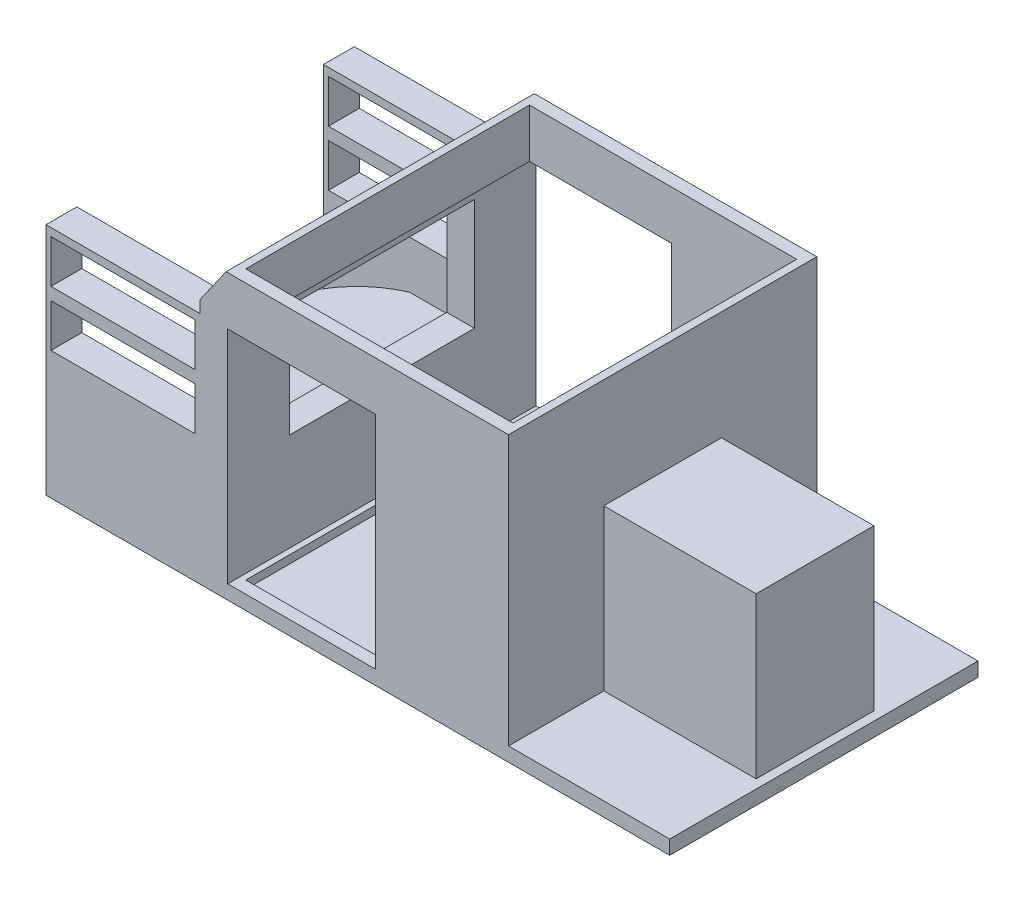
from build123d import *

# Parameters (mm, degrees)
SALIENTE_EXTRUIR1_DEPTH = 2300
CROQUIS2_W              = 1250
CROQUIS2_H              = 400
CORTAR_EXTRUIR1_DEPTH   = 2500
CORTAR_EXTRUIR2_DEPTH   = 2500
CROQUIS4_W              = 2166.414041003
CROQUIS4_H              = 2300
CORTAR_EXTRUIR3_DEPTH   = 2250
CROQUIS5_W              = 1170
CROQUIS5_H              = 350
CORTAR_EXTRUIR4_DEPTH   = 2500
MATRIZL1_COUNT          = 2
MATRIZL1_PITCH          = 450
CORTAR_EXTRUIR5_START   = -2500
CROQUIS7_W              = 1200
CROQUIS7_H              = 1790
CORTAR_EXTRUIR5_DEPTH   = 2500
CROQUIS8_W              = 1306.870998869
CROQUIS8_H              = 2500
SALIENTE_EXTRUIR2_DEPTH = 114.717432506
CROQUIS9_W              = 1235.333437109
CROQUIS9_H              = 954.540118574
SALIENTE_EXTRUIR3_DEPTH = 1300
SALIENTE_EXTRUIR4_DEPTH = 50
CROQUIS11_W             = 1500
CROQUIS11_H             = 904.540044025
CORTAR_EXTRUIR6_DEPTH   = 223.508326288


with BuildPart() as part:
    # Croquis1 → Saliente-Extruir1 (new body)
    with BuildSketch(Plane(origin=(0, 0, 0), x_dir=(1, 0, 0), z_dir=(0, 1, 0))):
        Polygon((-1875, 1000), (-625, 1000), (-625, -1000), (-1875, -1000), (-1875, -1250), (1875, -1250), (1875, 1250), (-1875, 1250), align=None)
    extrude(amount=SALIENTE_EXTRUIR1_DEPTH)

    # Croquis2 → Cortar-Extruir1 (cut)
    with BuildSketch(Plane.XY.offset(1250)):
        with Locations((-1250, 2100)):
            Rectangle(CROQUIS2_W, CROQUIS2_H)
    extrude(amount=-CORTAR_EXTRUIR1_DEPTH, mode=Mode.SUBTRACT)

    # Croquis3 → Cortar-Extruir2 (cut)
    with BuildSketch(Plane.XY.offset(1250)):
        Polygon((-625, 2000), (-414.937738537, 2300), (-625, 2300), align=None)
    extrude(amount=-CORTAR_EXTRUIR2_DEPTH, mode=Mode.SUBTRACT)

    # Croquis4 → Cortar-Extruir3 (cut)
    with BuildSketch(Plane(origin=(0, 2300, 0), x_dir=(1, 0, 0), z_dir=(0, 1, 0))):
        with Locations((728.269281965, 0)):
            Rectangle(CROQUIS4_W, CROQUIS4_H)
    extrude(amount=-CORTAR_EXTRUIR3_DEPTH, mode=Mode.SUBTRACT)

    # Croquis5 → Cortar-Extruir4 (cut)
    with BuildSketch(Plane.XY.offset(1250)):
        with Locations((-1250, 1661.719484632)):
            Rectangle(CROQUIS5_W, CROQUIS5_H)
    cortar_extruir4 = extrude(amount=-CORTAR_EXTRUIR4_DEPTH, mode=Mode.SUBTRACT)

    # MatrizL1: Cortar-Extruir4 ×2
    with Locations(*[(0, -i * MATRIZL1_PITCH, 0) for i in range(1, MATRIZL1_COUNT)]):
        add(cortar_extruir4, mode=Mode.SUBTRACT)

    # Croquis7 → Cortar-Extruir5 (cut)
    with BuildSketch(Plane.XY.offset(1250).offset(CORTAR_EXTRUIR5_START)):
        with Locations((198.508326288, 1009.717432506)):
            Rectangle(CROQUIS7_W, CROQUIS7_H)
    extrude(amount=CORTAR_EXTRUIR5_DEPTH, mode=Mode.SUBTRACT)

    # Croquis8 → Saliente-Extruir2 (add)
    with BuildSketch(Plane(origin=(0, 0, 0), x_dir=(1, 0, 0), z_dir=(0, 1, 0))):
        with Locations((2528.435499435, 0)):
            Rectangle(CROQUIS8_W, CROQUIS8_H)
    extrude(amount=SALIENTE_EXTRUIR2_DEPTH)

    # Croquis9 → Saliente-Extruir3 (add)
    with BuildSketch(Plane(origin=(0, 114.717432506, 0), x_dir=(1, 0, 0), z_dir=(0, 1, 0))):
        with Locations((2492.666718555, 0)):
            Rectangle(CROQUIS9_W, CROQUIS9_H)
    extrude(amount=SALIENTE_EXTRUIR3_DEPTH)

    # Croquis10 → Saliente-Extruir4 (add)
    with BuildSketch(Plane(origin=(0, 850, 0), x_dir=(1, 0, 0), z_dir=(0, 1, 0))):
        with BuildLine():
            Line((-625, 750), (-925, 750))
            ThreePointArc((-925, 750), (-1419.665058633, 0), (-925, -750))
            Line((-925, -750), (-625, -750))
            Line((-625, -750), (-625, 750))
        make_face()
    extrude(amount=SALIENTE_EXTRUIR4_DEPTH)

    # Croquis11 → Cortar-Extruir6 (cut)
    with BuildSketch(Plane.ZY.offset(625)):
        with Locations((0, 1361.538512049)):
            Rectangle(CROQUIS11_W, CROQUIS11_H)
    extrude(amount=-CORTAR_EXTRUIR6_DEPTH, mode=Mode.SUBTRACT)


solid = part.part
